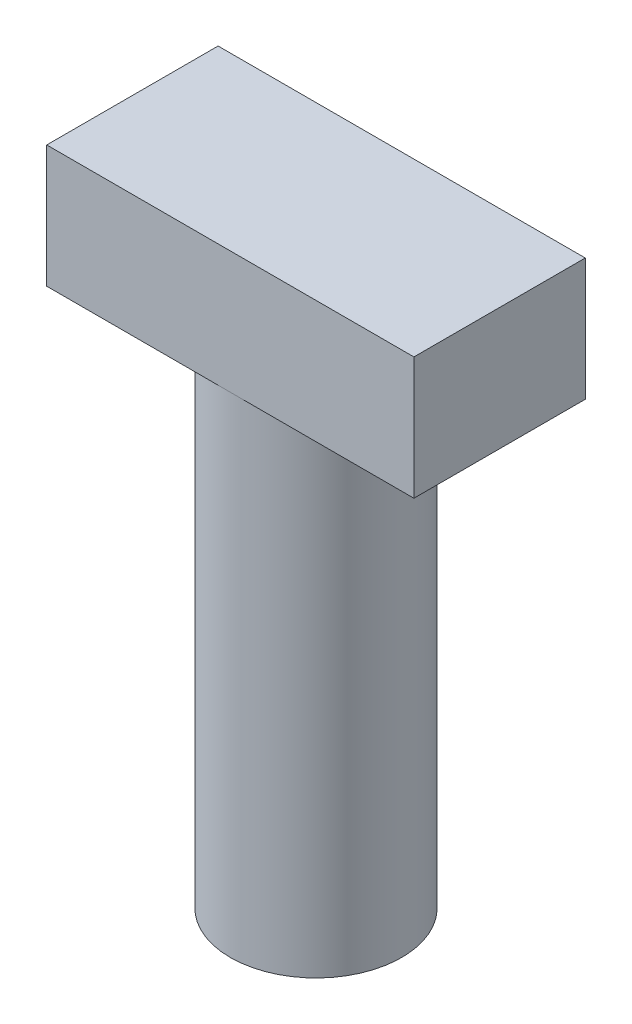
from build123d import *

# Parameters (mm, degrees)
SKETCH2_R           = 7
BOSS_EXTRUDE1_DEPTH = 40
SKETCH3_W           = 30
SKETCH3_H           = 14
BOSS_EXTRUDE2_DEPTH = 10


with BuildPart() as part:
    # Sketch2 → Boss-Extrude1 (new body)
    with BuildSketch(Plane(origin=(0, 0, 0), x_dir=(1, 0, 0), z_dir=(0, 1, 0))):
        with Locations(Location((0, 0, 0), (0, 0, 270))):
            Circle(SKETCH2_R)
    extrude(amount=BOSS_EXTRUDE1_DEPTH)

    # Sketch3 → Boss-Extrude2 (add)
    with BuildSketch(Plane(origin=(0, 40, 0), x_dir=(1, 0, 0), z_dir=(0, 1, 0))):
        Rectangle(SKETCH3_W, SKETCH3_H)
    extrude(amount=BOSS_EXTRUDE2_DEPTH)


solid = part.part
